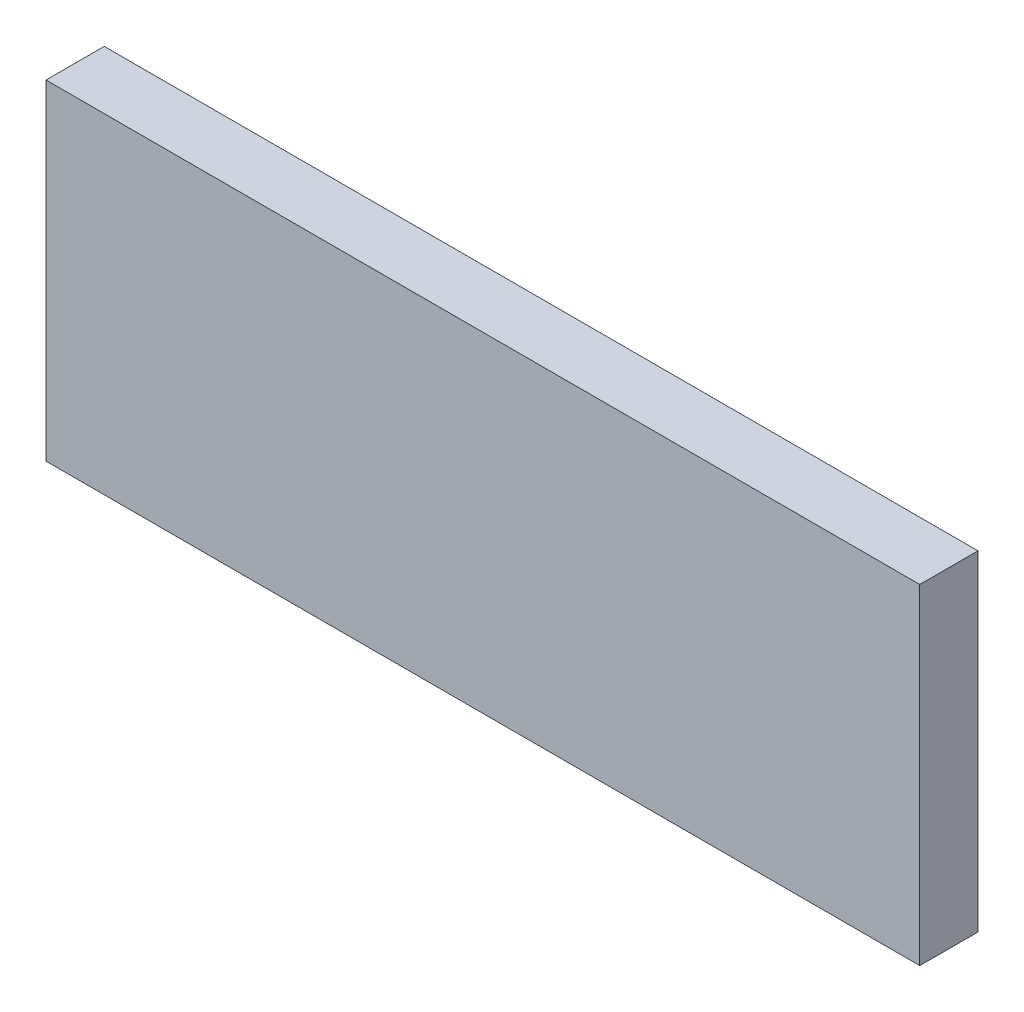
from build123d import *

# Parameters (mm, degrees)
SKETCH2_W           = 4500
SKETCH2_H           = 1700
BOSS_EXTRUDE1_DEPTH = 300
SHELL1_T            = 10


with BuildPart() as part:
    # Sketch2 → Boss-Extrude1 (new body)
    with BuildSketch(Plane.XY):
        with Locations((2250, 850)):
            Rectangle(SKETCH2_W, SKETCH2_H)
    extrude(amount=BOSS_EXTRUDE1_DEPTH)

    # Shell1 (no face opened: a closed hollow body)
    add(offset(amount=-SHELL1_T, mode=Mode.PRIVATE), mode=Mode.SUBTRACT)


solid = part.part
